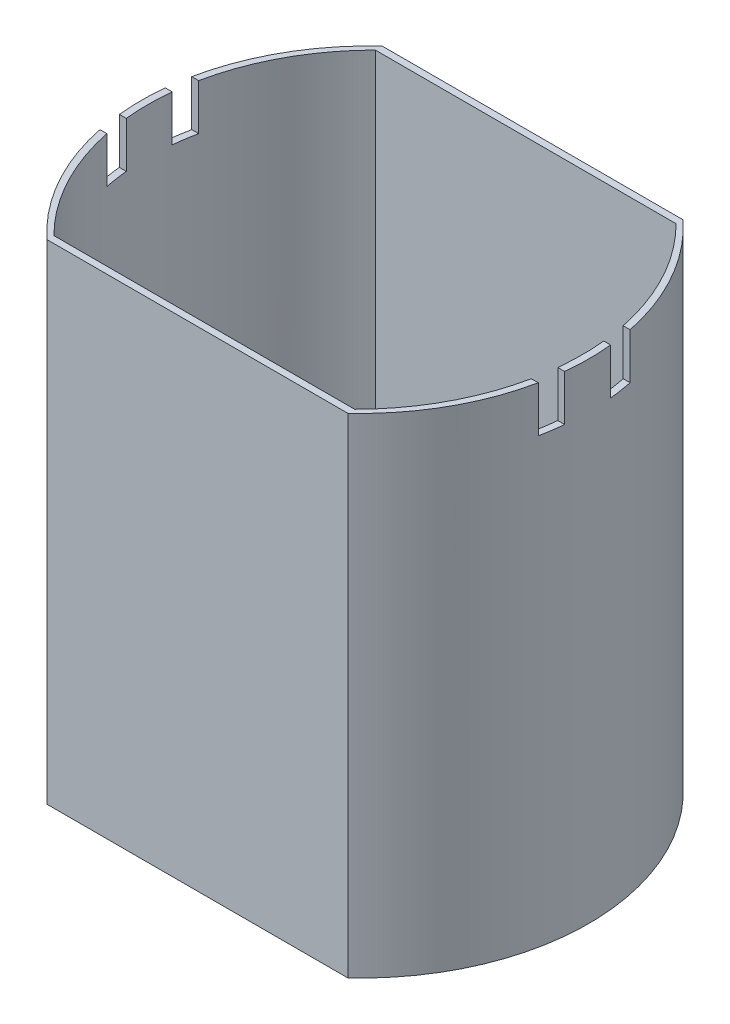
from build123d import *

# Parameters (mm, degrees)
BOSS_EXTRUDE1_DEPTH = 21
BOSS_EXTRUDE2_START = -0.3
SKETCH3_R           = 0.9
BOSS_EXTRUDE2_DEPTH = 0.3
CUT_EXTRUDE1_DEPTH  = 2


with BuildPart() as part:
    # Sketch2 → Boss-Extrude1 (new body)
    with BuildSketch(Plane(origin=(0, 0, 0), x_dir=(1, 0, 0), z_dir=(0, 1, 0))):
        with BuildLine():
            Line((-6.55, 7.3), (6.55, 7.3))
            ThreePointArc((6.55, 7.3), (9.75, 0), (6.55, -7.3))
            Line((6.55, -7.3), (-6.55, -7.3))
            ThreePointArc((-6.55, -7.3), (-9.75, 0), (-6.55, 7.3))
        make_face()
        with BuildLine():
            Line((-6.55, 7), (6.55, 7))
            ThreePointArc((6.55, 7), (9.449494937, 0), (6.55, -7))
            Line((6.55, -7), (-6.55, -7))
            ThreePointArc((-6.55, -7), (-9.449494937, 0), (-6.55, 7))
        make_face(mode=Mode.SUBTRACT)
    extrude(amount=BOSS_EXTRUDE1_DEPTH)

    # Sketch3 → Boss-Extrude2 (add)
    with BuildSketch(Plane(origin=(0, 0, 0), x_dir=(1, 0, 0), z_dir=(0, 1, 0)).offset(BOSS_EXTRUDE2_START)):
        with BuildLine():
            Line((-6.55, 7.3), (6.55, 7.3))
            ThreePointArc((6.55, 7.3), (9.75, 0), (6.55, -7.3))
            Line((6.55, -7.3), (-6.55, -7.3))
            ThreePointArc((-6.55, -7.3), (-9.75, 0), (-6.55, 7.3))
        make_face()
        with Locations(Location((0, 0, 0), (0, 0, 270))):
            Circle(SKETCH3_R, mode=Mode.SUBTRACT)
    extrude(amount=BOSS_EXTRUDE2_DEPTH)

    # Sketch4 → Cut-Extrude1 (cut)
    with BuildSketch(Plane(origin=(0, 21, 0), x_dir=(1, 0, 0), z_dir=(0, 1, 0))):
        Polygon((-7.631188375, 1), (-14.631115783, 1), (-14.631115783, -1), (-7.538875612, -1), (-7.538875612, -2), (-15.384565747, -2), (-15.384565747, 2), (-7.631188375, 2), align=None)
        Polygon((7.631188375, 2), (7.631188375, 1), (14.631115783, 1), (14.631115783, -1), (7.538875612, -1), (7.538875612, -2), (15.384565747, -2), (15.384565747, 2), align=None)
    extrude(amount=-CUT_EXTRUDE1_DEPTH, mode=Mode.SUBTRACT)


solid = part.part
